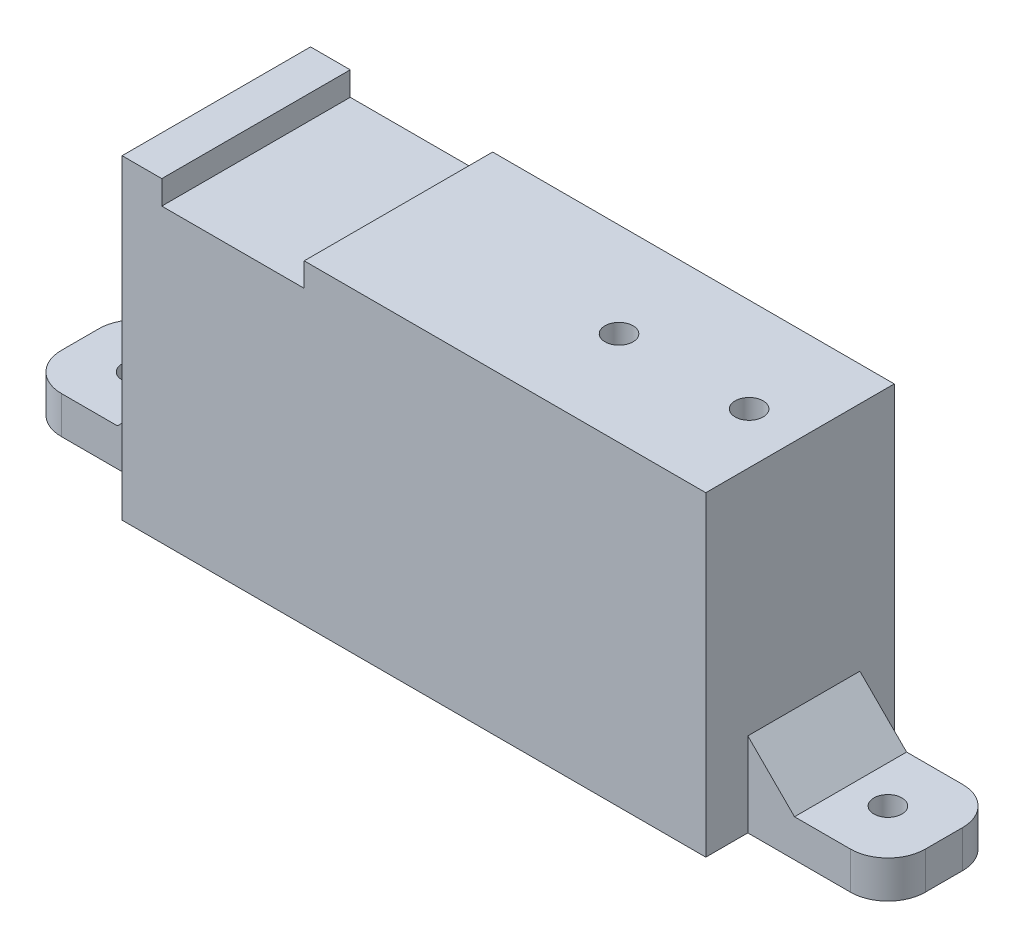
from build123d import *

# Parameters (mm, degrees)
SKETCH_219_W        = 62.5
SKETCH_219_H        = 20.18
EXTRUDE_1_DEPTH     = 33.8
SKETCH_6_W          = 15.25
SKETCH_6_H          = 20.18
CUT_EXTRUDE_1_DEPTH = 2.55
SKETCH_7_R          = 1.5
CUT_EXTRUDE_2_DEPTH = 15
SKETCH_8_R          = 1.5
EXTRUDE_2_DEPTH     = 4
CHAMFER_1_SIZE      = 5
CHAMFER_2_SIZE      = 5


with BuildPart() as part:
    # Sketch 219 → Бобышка-Вытянуть1 (new body)
    with BuildSketch(Plane(origin=(0, 0, 0), x_dir=(1, 0, 0), z_dir=(0, 1, 0))):
        Rectangle(SKETCH_219_W, SKETCH_219_H)
    extrude(amount=EXTRUDE_1_DEPTH)

    # Эскиз6 → Вырез-Вытянуть1 (cut)
    with BuildSketch(Plane(origin=(0, 33.8, 0), x_dir=(1, 0, 0), z_dir=(0, 1, 0))):
        with Locations((-19.375, 0)):
            Rectangle(SKETCH_6_W, SKETCH_6_H)
    extrude(amount=-CUT_EXTRUDE_1_DEPTH, mode=Mode.SUBTRACT)

    # Эскиз7 → Вырез-Вытянуть2 (cut)
    with BuildSketch(Plane(origin=(0, 33.8, 0), x_dir=(1, 0, 0), z_dir=(0, 1, 0))):
        with BuildLine():
            ThreePointArc((27.3, 0), (25.8, 1.5), (24.3, 0))
            Line((24.3, 0), (27.3, 0))
        make_face()
        with BuildLine():
            Line((27.3, 0), (24.3, 0))
            ThreePointArc((24.3, 0), (25.8, -1.5), (27.3, 0))
        make_face()
        with Locations(Location((11.87, 0, 0), (0, 0, 270))):
            Circle(SKETCH_7_R)
    extrude(amount=-CUT_EXTRUDE_2_DEPTH, mode=Mode.SUBTRACT)

    # Эскиз8 → Бобышка-Вытянуть2 (add)
    # profile 1 of 2: a face of its own
    with BuildSketch(Plane.XZ):
        with BuildLine():
            Line((-31.25, 5.59), (-42.25, 5.59))
            ThreePointArc((-42.25, 5.59), (-45.078427125, 4.418427125), (-46.25, 1.59))
            Line((-46.25, 1.59), (-46.25, -2.41))
            ThreePointArc((-46.25, -2.41), (-45.078427125, -5.238427125), (-42.25, -6.41))
            Line((-42.25, -6.41), (-31.25, -6.41))
            Line((-31.25, -6.41), (-31.25, 5.59))
        make_face()
        with Locations(Location((-40.25, -0.41, 0), (0, 0, 270))):
            Circle(SKETCH_8_R, mode=Mode.SUBTRACT)
    # profile 2 of 2: a face of its own
    with BuildSketch(Plane.XZ):
        with BuildLine():
            Line((31.25, -6.41), (42.25, -6.41))
            ThreePointArc((42.25, -6.41), (45.078427125, -5.238427125), (46.25, -2.41))
            Line((46.25, -2.41), (46.25, 1.59))
            ThreePointArc((46.25, 1.59), (45.078427125, 4.418427125), (42.25, 5.59))
            Line((42.25, 5.59), (31.25, 5.59))
            Line((31.25, 5.59), (31.25, -6.41))
        make_face()
        with Locations(Location((40.25, -0.41, 0), (0, 0, 90))):
            Circle(SKETCH_8_R, mode=Mode.SUBTRACT)
    extrude(amount=-EXTRUDE_2_DEPTH)

    # Фаска1
    chamfer_1_edges = [part.edges().sort_by_distance(p)[0] for p in [
        (-31.25, 4, -0.41),
    ]]
    chamfer(chamfer_1_edges, length=CHAMFER_1_SIZE)

    # Фаска2
    chamfer_2_edges = [part.edges().sort_by_distance(p)[0] for p in [
        (31.25, 4, -0.41),
    ]]
    chamfer(chamfer_2_edges, length=CHAMFER_2_SIZE)


solid = part.part
